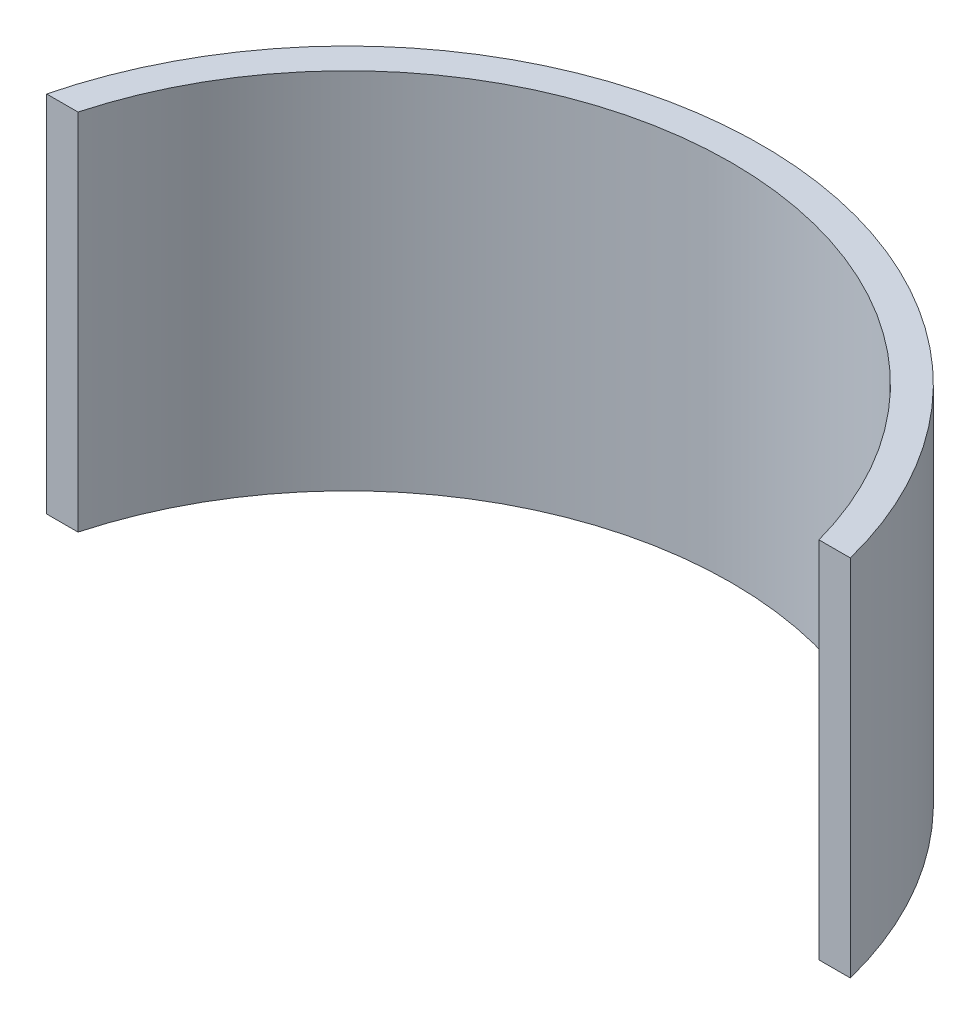
from build123d import *

# Parameters (mm, degrees)
BOSS_EXTRUDE1_DEPTH = 18


with BuildPart() as part:
    # Sketch1 → Boss-Extrude1 (new body)
    with BuildSketch(Plane(origin=(0, 0, 0), x_dir=(1, 0, 0), z_dir=(0, 1, 0))):
        with BuildLine():
            Line((-19.880895352, 5), (-18.33030278, 5))
            ThreePointArc((-18.33030278, 5), (0, 19), (18.33030278, 5))
            Line((18.33030278, 5), (19.880895352, 5))
            ThreePointArc((19.880895352, 5), (0, 20.5), (-19.880895352, 5))
        make_face()
    extrude(amount=BOSS_EXTRUDE1_DEPTH)


solid = part.part
